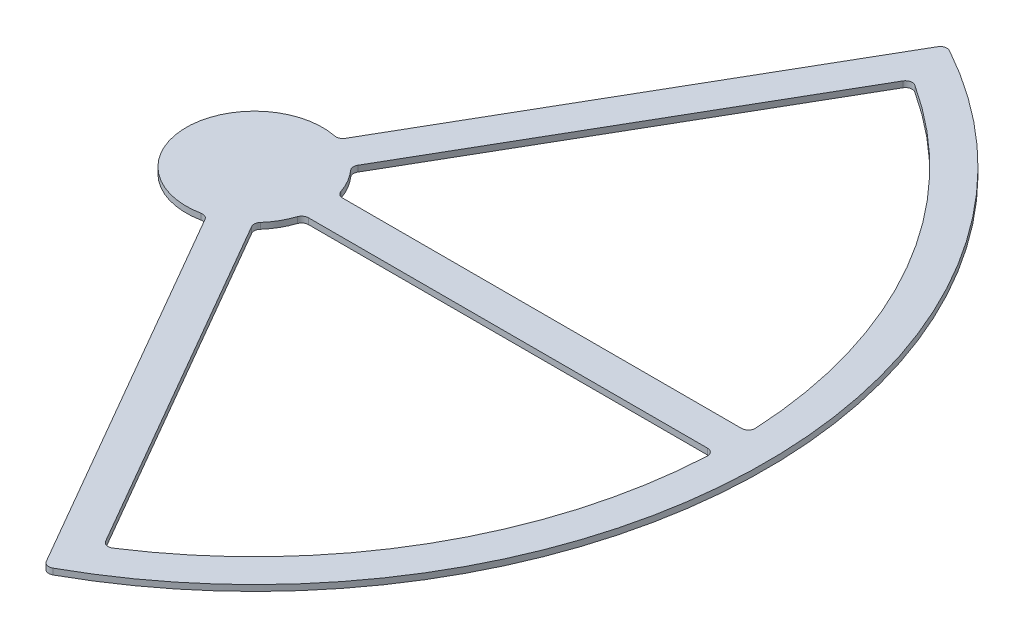
from build123d import *

# Parameters (mm, degrees)
BOSS_EXTRUDE1_DEPTH = 1.75


with BuildPart() as part:
    # Sketch1 → Boss-Extrude1 (new body)
    with BuildSketch(Plane(origin=(0, 0, 0), x_dir=(1, 0, 0), z_dir=(0, 1, 0))):
        with BuildLine():
            Line((6.098199788, 20.562391868), (69.654668716, 130.645425201))
            ThreePointArc((69.654668716, 130.645425201), (70.84952744, 131.571931019), (72.351404923, 131.397390407))
            ThreePointArc((72.351404923, 131.397390407), (150, 0), (72.351404923, -131.397390407))
            ThreePointArc((72.351404923, -131.397390407), (70.84952744, -131.571931019), (69.654668716, -130.645425201))
            Line((69.654668716, -130.645425201), (6.098199788, -20.562391868))
            ThreePointArc((6.098199788, -20.562391868), (5.188430073, -19.739247934), (3.969226346, -19.602174426))
            ThreePointArc((3.969226346, -19.602174426), (-20, 0), (3.969226346, 19.602174426))
            ThreePointArc((3.969226346, 19.602174426), (5.188430073, 19.739247934), (6.098199788, 20.562391868))
        make_face()
        with BuildLine():
            Line((20.856653615, 5), (137.822349421, 5))
            ThreePointArc((137.822349421, 5), (139.271987057, 5.622120933), (139.819774775, 7.101449275))
            ThreePointArc((139.819774775, 7.101449275), (121.24355653, 70), (76.059922864, 117.536752269))
            ThreePointArc((76.059922864, 117.536752269), (74.504893079, 117.802018361), (73.24130173, 116.857655808))
            Line((73.24130173, 116.857655808), (14.758453826, 15.562391868))
            ThreePointArc((14.758453826, 15.562391868), (14.500475126, 14.362936215), (14.991367849, 13.238538062))
            ThreePointArc((14.991367849, 13.238538062), (17.320508076, 10), (18.960594195, 6.363636364))
            ThreePointArc((18.960594195, 6.363636364), (19.688905198, 5.376311718), (20.856653615, 5))
        make_face(mode=Mode.SUBTRACT)
        with BuildLine():
            Line((20.856653615, -5), (137.822349421, -5))
            ThreePointArc((137.822349421, -5), (139.271987057, -5.622120933), (139.819774775, -7.101449275))
            ThreePointArc((139.819774775, -7.101449275), (121.24355653, -70), (76.059922864, -117.536752269))
            ThreePointArc((76.059922864, -117.536752269), (74.504893079, -117.802018361), (73.24130173, -116.857655808))
            Line((73.24130173, -116.857655808), (14.758453826, -15.562391868))
            ThreePointArc((14.758453826, -15.562391868), (14.500475126, -14.362936215), (14.991367849, -13.238538062))
            ThreePointArc((14.991367849, -13.238538062), (17.320508076, -10), (18.960594195, -6.363636364))
            ThreePointArc((18.960594195, -6.363636364), (19.688905198, -5.376311718), (20.856653615, -5))
        make_face(mode=Mode.SUBTRACT)
    extrude(amount=BOSS_EXTRUDE1_DEPTH)


solid = part.part
